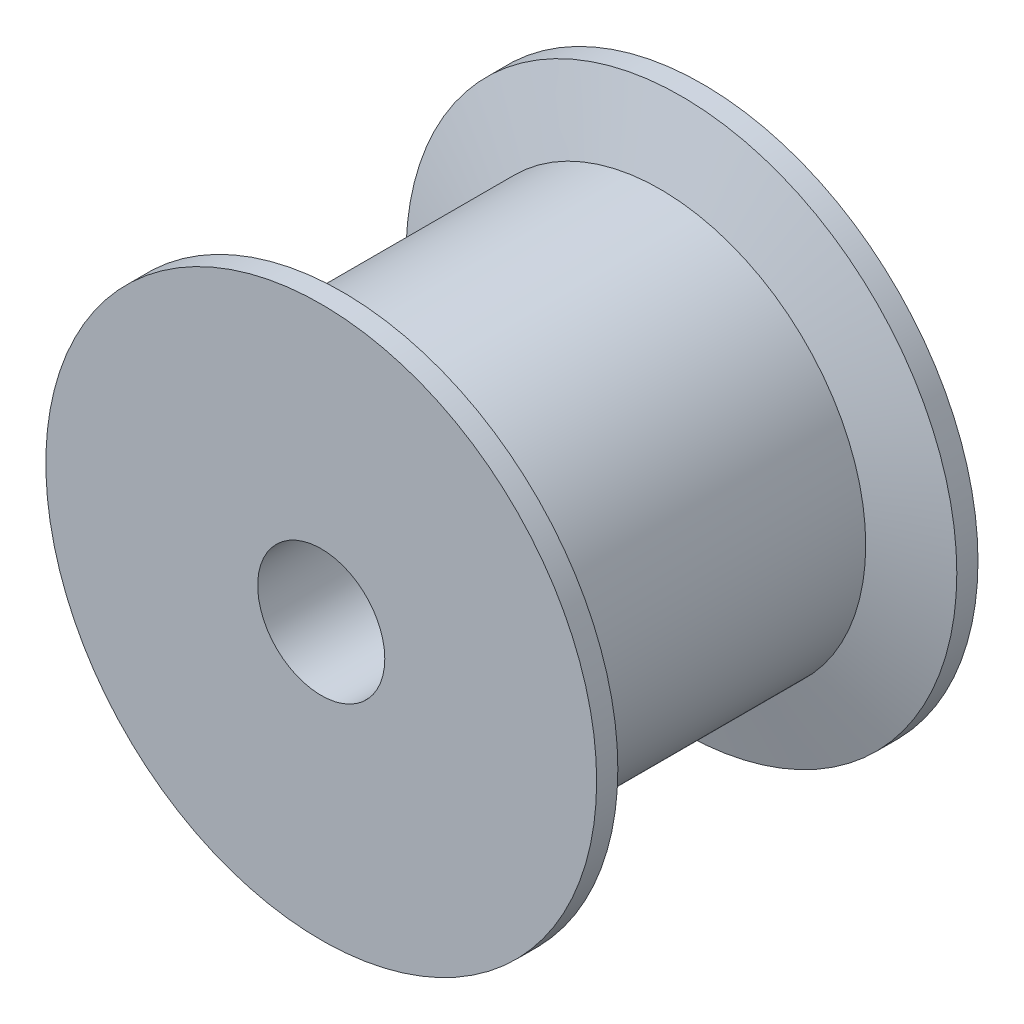
from build123d import *


with BuildPart() as part:
    # Эскиз1 → Повернуть1 (revolve)
    with BuildSketch(Plane(origin=(0, 0, 0), x_dir=(0, 0, -1), z_dir=(1, 0, 0)), mode=Mode.PRIVATE) as revolve_1_sk:
        Polygon((3.5, 4.85), (4, 6.5), (4.5, 6.5), (4.5, 1.5), (-4.5, 1.5), (-4.5, 6.5), (-4, 6.5), (-3.5, 4.85), align=None)
    revolve(revolve_1_sk.sketch.rotate(Axis((0, 0, 0), (0, 0, -1)), 90), axis=Axis((0, 0, 0), (0, 0, -1)))


solid = part.part
